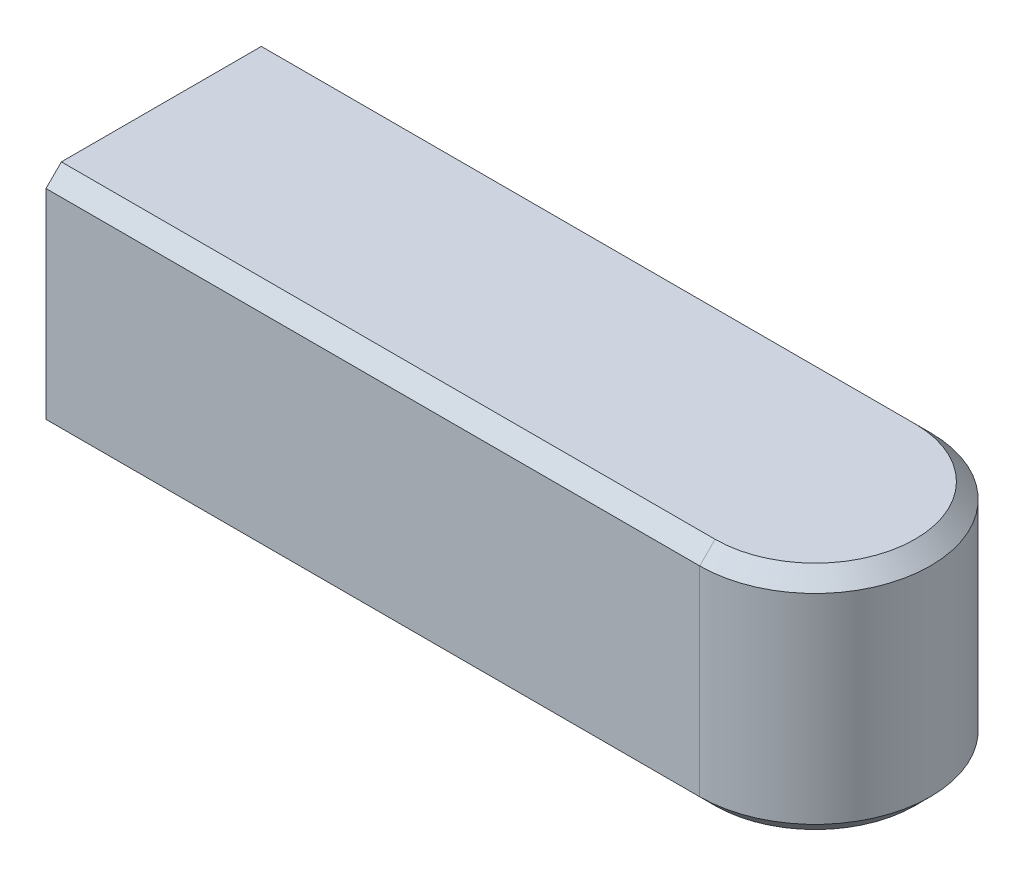
from build123d import *

# Parameters (mm, degrees)
SKETCH1_W           = 10
SKETCH1_H           = 3
BOSS_EXTRUDE1_DEPTH = 3
FILLET2_RADIUS      = 1.5
FILLET2_LENGTH      = 3
CHAMFER2_SIZE       = 0.2


with BuildPart() as part:
    # Sketch1 → Boss-Extrude1 (new body)
    with BuildSketch(Plane(origin=(0, 0, 0), x_dir=(1, 0, 0), z_dir=(0, 1, 0))):
        Rectangle(SKETCH1_W, SKETCH1_H)
    extrude(amount=BOSS_EXTRUDE1_DEPTH)

    # Fillet2: full round fillet: the end face becomes a half cylinder, R = half its width
    fillet2_face = Plane((5, 1.5, 0), x_dir=(0, 1, 0), z_dir=(1, 0, 0))  # on the end face: x along it, z out of the body
    fillet2_slab = fillet2_face.offset(-FILLET2_RADIUS / 2) * Box(FILLET2_LENGTH, 2 * FILLET2_RADIUS, FILLET2_RADIUS, mode=Mode.PRIVATE)  # the body's end, R deep
    fillet2_round = Plane((3.5, 1.5, 0), x_dir=(1, 0, 0), z_dir=(0, 1, 0)) * Cylinder(FILLET2_RADIUS, FILLET2_LENGTH, mode=Mode.PRIVATE)  # its axis R under the face
    add(fillet2_slab - fillet2_round, mode=Mode.SUBTRACT)

    # Chamfer2
    chamfer2_edges = [part.edges().sort_by_distance(p)[0] for p in [
        (-0.75, 0, -1.5),
        (-0.75, 3, -1.5),
        (5, 0, 0),
        (5, 3, 0),
        (-0.75, 0, 1.5),
        (-0.75, 3, 1.5),
    ]]
    chamfer(chamfer2_edges, length=CHAMFER2_SIZE)


solid = part.part
